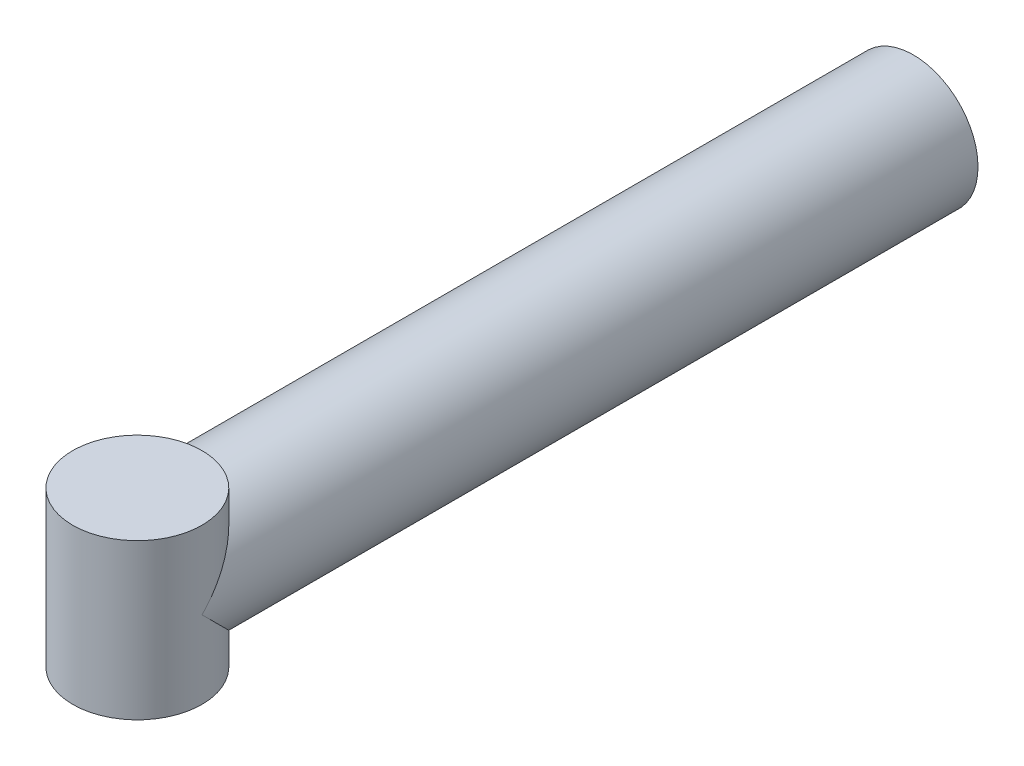
from build123d import *

# Parameters (mm, degrees)
CROQUIS1_R              = 6.25
SALIENTE_EXTRUIR1_DEPTH = 75
CROQUIS2_R              = 6.25
SALIENTE_EXTRUIR2_DEPTH = 7.5


with BuildPart() as part:
    # Croquis1 → Saliente-Extruir1 (new body)
    with BuildSketch(Plane.XY):
        Circle(CROQUIS1_R)
    extrude(amount=SALIENTE_EXTRUIR1_DEPTH)

    # Croquis2 → Saliente-Extruir2 (add, symmetric)
    with BuildSketch(Plane(origin=(0, 0, 0), x_dir=(1, 0, 0), z_dir=(0, 1, 0))):
        with Locations(Location((0, -75, 0), (0, 0, 270))):
            Circle(CROQUIS2_R)
    extrude(amount=SALIENTE_EXTRUIR2_DEPTH, both=True)


solid = part.part
